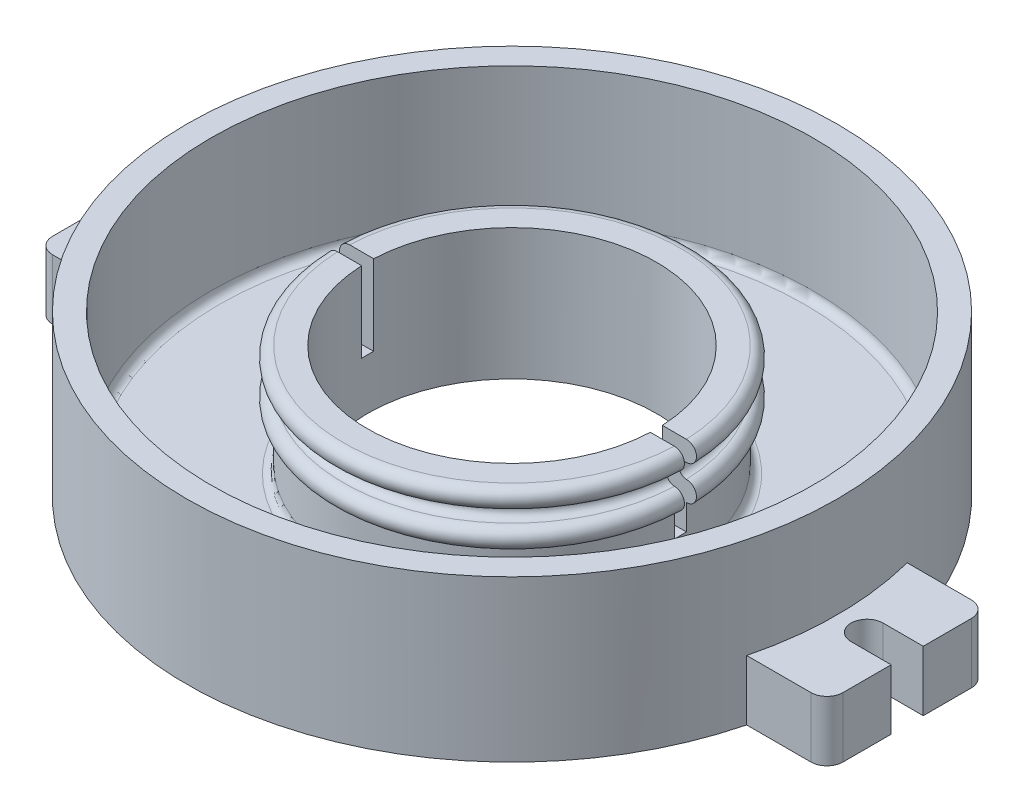
from build123d import *

# Parameters (mm, degrees)
BOSS_EXTRUDE1_START = -15
BOSS_EXTRUDE1_DEPTH = 15
FILLET3_R           = 2
SKETCH4_W           = 120
SKETCH4_H           = 3
CUT_EXTRUDE1_DEPTH  = 20
CUT_EXTRUDE2_START  = -10
SKETCH5_W           = 40
SKETCH5_H           = 8.8
CUT_EXTRUDE2_DEPTH  = 10


with BuildPart() as part:
    # Sketch2 → Revolve1 (revolve)
    with BuildSketch(Plane.XY):
        with BuildLine():
            Line((0, 0), (0, 40))
            Line((0, 40), (6, 40))
            Line((6, 40), (6, 5))
            Line((6, 5), (39, 5))
            Line((39, 5), (39, 19))
            ThreePointArc((39, 19), (36.5, 21.5), (39, 24))
            ThreePointArc((39, 24), (40.830127019, 25.830127019), (39, 27.660254038))
            ThreePointArc((39, 27.660254038), (36.5, 30.160254038), (39, 32.660254038))
            Line((39, 32.660254038), (45, 32.660254038))
            Line((45, 32.660254038), (45, 0))
            Line((45, 0), (0, 0))
        make_face()
    revolve(axis=Axis((81, 93.537735849, 0), (0, -1, 0)))

    # Sketch3 → Boss-Extrude1 (add)
    with BuildSketch(Plane.XZ.offset(BOSS_EXTRUDE1_START)):
        with BuildLine():
            ThreePointArc((-13.492037813, 20), (-16.320464938, 18.828427125), (-17.492037813, 16))
            Line((-17.492037813, 16), (-17.492037813, 4))
            Line((-17.492037813, 4), (-7.492037813, 4))
            ThreePointArc((-7.492037813, 4), (-3.492037813, 0), (-7.492037813, -4))
            Line((-7.492037813, -4), (-17.492037813, -4))
            Line((-17.492037813, -4), (-17.492037813, -16))
            ThreePointArc((-17.492037813, -16), (-16.320464938, -18.828427125), (-13.492037813, -20))
            Line((-13.492037813, -20), (2.507962187, -20))
            ThreePointArc((2.507962187, -20), (0, 0), (2.507962187, 20))
            Line((2.507962187, 20), (-13.492037813, 20))
        make_face()
        with BuildLine():
            Line((159.492037813, -20), (175.492037813, -20))
            ThreePointArc((175.492037813, -20), (178.320464938, -18.828427125), (179.492037813, -16))
            Line((179.492037813, -16), (179.492037813, -4))
            Line((179.492037813, -4), (169.492037813, -4))
            ThreePointArc((169.492037813, -4), (165.492037813, 0), (169.492037813, 4))
            Line((169.492037813, 4), (179.492037813, 4))
            Line((179.492037813, 4), (179.492037813, 16))
            ThreePointArc((179.492037813, 16), (178.320464938, 18.828427125), (175.492037813, 20))
            Line((175.492037813, 20), (159.492037813, 20))
            ThreePointArc((159.492037813, 20), (162, 0), (159.492037813, -20))
        make_face()
    extrude(amount=BOSS_EXTRUDE1_DEPTH)

    # Fillet3
    fillet3_edges = [part.edges().sort_by_distance(p)[0] for p in [
        (123, 5, 0),
        (156, 5, 0),
    ]]
    fillet(fillet3_edges, radius=FILLET3_R)

    # Sketch4 → Cut-Extrude1 (cut)
    with BuildSketch(Plane(origin=(0, 32.660254038, 0), x_dir=(1, 0, 0), z_dir=(0, 1, 0))):
        with Locations((81, 0)):
            Rectangle(SKETCH4_W, SKETCH4_H)
    extrude(amount=-CUT_EXTRUDE1_DEPTH, mode=Mode.SUBTRACT)

    # Sketch5 → Cut-Extrude2 (cut)
    with BuildSketch(Plane(origin=(0, 5, 0), x_dir=(1, 0, 0), z_dir=(0, 1, 0)).offset(CUT_EXTRUDE2_START)):
        with Locations((81, -49.4)):
            Rectangle(SKETCH5_W, SKETCH5_H)
        with BuildLine():
            ThreePointArc((45.031263575, 1.5), (45, 0), (45.031263575, -1.5))
            ThreePointArc((45.031263575, -1.5), (81, -36), (116.968736425, -1.5))
            ThreePointArc((116.968736425, -1.5), (117, 0), (116.968736425, 1.5))
            ThreePointArc((116.968736425, 1.5), (81, 36), (45.031263575, 1.5))
        make_face()
    extrude(amount=CUT_EXTRUDE2_DEPTH, mode=Mode.SUBTRACT)


solid = part.part
